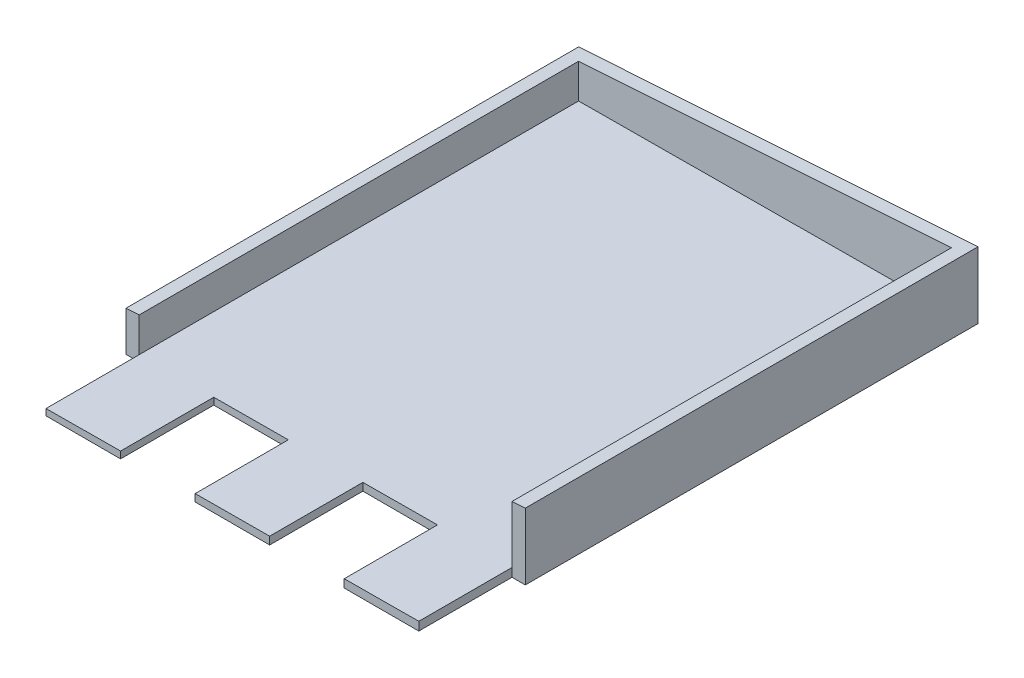
from build123d import *

# Parameters (mm, degrees)
BOSS_EXTRUDE1_DEPTH = 170
CUT_EXTRUDE1_DEPTH  = 165
BOSS_EXTRUDE2_DEPTH = 35
BOSS_EXTRUDE3_DEPTH = 35


with BuildPart() as part:
    # Sketch1 → Boss-Extrude1 (new body)
    with BuildSketch(Plane.XY):
        Polygon((0, 0), (0, -15), (150, -15), (150, 10), align=None)
    extrude(amount=BOSS_EXTRUDE1_DEPTH)

    # Sketch2 → Cut-Extrude1 (cut)
    with BuildSketch(Plane.XY.offset(170)):
        Polygon((5, 0.333333333), (5, -12.6), (145, -11.8), (145, 9.666666667), align=None)
    extrude(amount=-CUT_EXTRUDE1_DEPTH, mode=Mode.SUBTRACT)

    # Sketch3 → Boss-Extrude2 (add)
    with BuildSketch(Plane.XY.offset(170)):
        Polygon((145, -11.8), (145, -15), (117, -15), (117, -11.96), align=None)
    extrude(amount=BOSS_EXTRUDE2_DEPTH)

    # Sketch4 → Boss-Extrude3 (add)
    with BuildSketch(Plane.XY.offset(170)):
        Polygon((89, -12.12), (89, -15), (61, -15), (61, -12.28), align=None)
        Polygon((5, -12.6), (5, -15), (33, -15), (33, -12.44), align=None)
    extrude(amount=BOSS_EXTRUDE3_DEPTH)


solid = part.part
